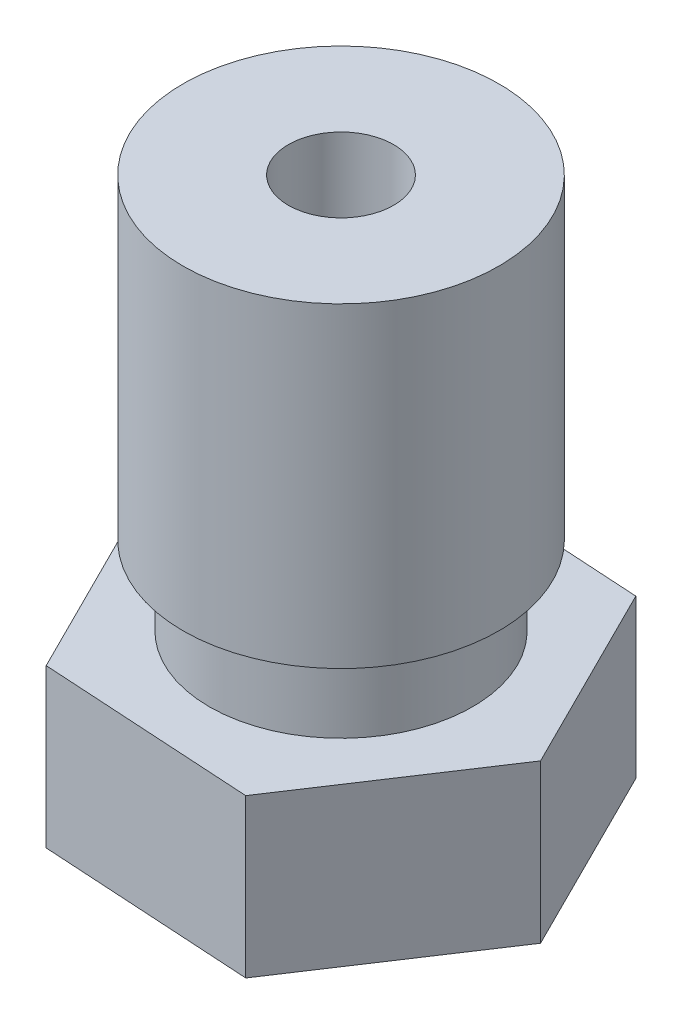
from build123d import *

# Parameters (mm, degrees)
P_IDAT_VYSUNUT_M1_DEPTH  = 3
SKICA3_R                 = 1
ODEBRAT_VYSUNUT_M1_DEPTH = 3


with BuildPart() as part:
    # Skica1 → Rotovat1 (revolve)
    with BuildSketch(Plane.XY, mode=Mode.PRIVATE) as rotovat1_sk:
        Polygon((1, 5.88592233), (3, 5.88592233), (3, -0.11407767), (2.5, -0.11407767), (2.5, -1.61407767), (3.5, -1.61407767), (3.5, -4.61407767), (3.171296013, -4.61407767), (0.315, -6.61407767), (0.15, -6.61407767), (0.15, -6.11407767), (0.5, -5.76407767), (0.5, -5.11407767), (1, -4.61407767), align=None)
    revolve(rotovat1_sk.sketch.rotate(Axis((0, 5.88592233, 0), (0, -1, 0)), 90), axis=Axis((0, 5.88592233, 0), (0, -1, 0)))

    # Skica2 → Přidat vysunutím1 (add)
    with BuildSketch(Plane(origin=(0, -1.61407767, 0), x_dir=(1, 0, 0), z_dir=(0, 1, 0))):
        Polygon((-4.03408582, 0.243895321), (-2.228262454, -3.371673141), (1.805823366, -3.615568462), (4.03408582, -0.243895321), (2.228262454, 3.371673141), (-1.805823366, 3.615568462), align=None)
    extrude(amount=-P_IDAT_VYSUNUT_M1_DEPTH)

    # Skica3 → Odebrat vysunutím1 (cut)
    with BuildSketch(Plane(origin=(0, -1.61407767, 0), x_dir=(1, 0, 0), z_dir=(0, 1, 0))):
        with Locations(Location((0, 0, 0), (0, 0, 270))):
            Circle(SKICA3_R)
    extrude(amount=-ODEBRAT_VYSUNUT_M1_DEPTH, mode=Mode.SUBTRACT)


solid = part.part
